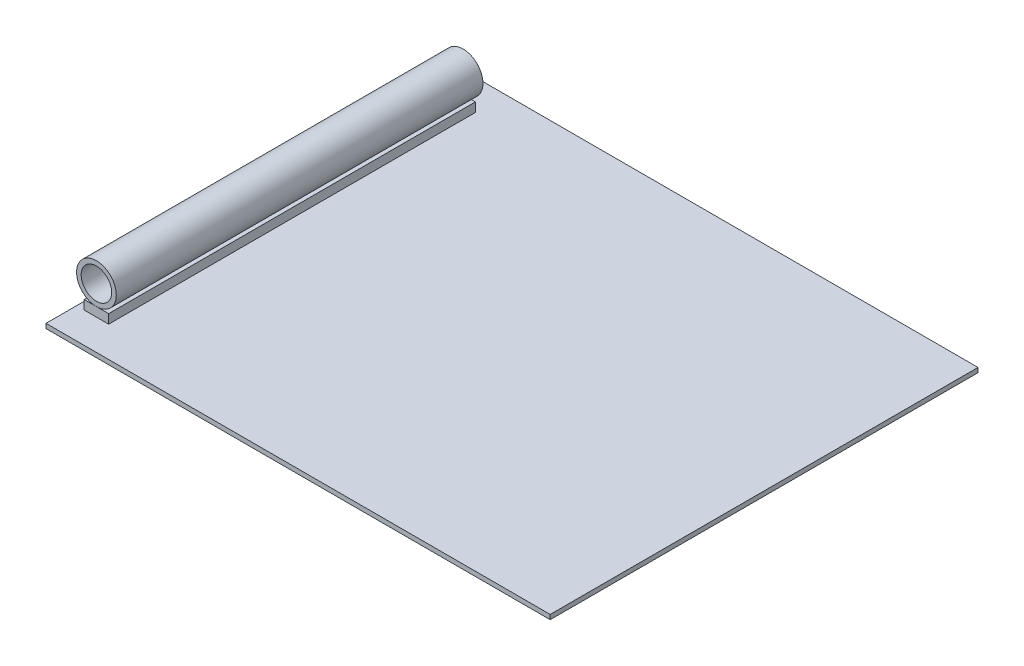
from build123d import *

# Parameters (mm, degrees)
BOSS_EXTRU_1_DEPTH           = 70
BOSS_EXTRU_1_DEPTH_BACK      = 70
BOSS_EXTRU_1_2_DEPTH         = 70
BOSS_EXTRU_1_2_DEPTH_BACK    = 70
ESQUISSE1_R                  = 6.5
ESQUISSE1_R_2                = 5
ENL_V_MAT_EXTRU_1_DEPTH      = 10
ENL_V_MAT_EXTRU_1_DEPTH_BACK = 20
ESQUISSE2_W                  = 10
ESQUISSE2_H                  = 17


with BuildPart() as part:
    # Esquisse1 → Boss.-Extru.1 (new, two sides: drawn at the far end of the back side and taken through both)
    with BuildSketch(Plane.XY.offset(-BOSS_EXTRU_1_DEPTH_BACK)):
        Polygon((0, 1.5), (0, 0), (165, 0), (165, 1.5), (10.5, 1.5), (10.5, 4.5), (6.5, 4.5), (2.5, 4.5), (2.5, 1.5), align=None)
    extrude(amount=BOSS_EXTRU_1_DEPTH + BOSS_EXTRU_1_DEPTH_BACK)


with BuildPart() as body_2:
    # Esquisse1 → Boss.-Extru.1 2 (new, two sides: drawn at the far end of the back side and taken through both)
    with BuildSketch(Plane.XY.offset(-BOSS_EXTRU_1_2_DEPTH_BACK)):
        with Locations((6.5, 11)):
            Circle(ESQUISSE1_R)
        with Locations((6.5, 11)):
            Circle(ESQUISSE1_R_2, mode=Mode.SUBTRACT)
    extrude(amount=BOSS_EXTRU_1_2_DEPTH + BOSS_EXTRU_1_2_DEPTH_BACK)


with BuildPart() as enl_v_mat_extru_1_tool:
    # Esquisse2 → Enlèv. mat.-Extru.1 (new, two sides: drawn at the far end of the back side and taken through both)
    with BuildSketch(Plane.ZY.offset(-2.5).offset(-ENL_V_MAT_EXTRU_1_DEPTH_BACK)):
        with Locations((-65, 10)):
            Rectangle(ESQUISSE2_W, ESQUISSE2_H)
        with Locations((65, 10)):
            Rectangle(ESQUISSE2_W, ESQUISSE2_H)
    extrude(amount=ENL_V_MAT_EXTRU_1_DEPTH + ENL_V_MAT_EXTRU_1_DEPTH_BACK)


with BuildPart() as part_1:
    add(part.part)

    # Enlèv. mat.-Extru.1: cut by enl_v_mat_extru_1_tool
    add(enl_v_mat_extru_1_tool.part, mode=Mode.SUBTRACT)


with BuildPart() as body_2_1:
    add(body_2.part)

    # Enlèv. mat.-Extru.1: cut by enl_v_mat_extru_1_tool
    add(enl_v_mat_extru_1_tool.part, mode=Mode.SUBTRACT)


solid = Compound([part_1.part, body_2_1.part])
